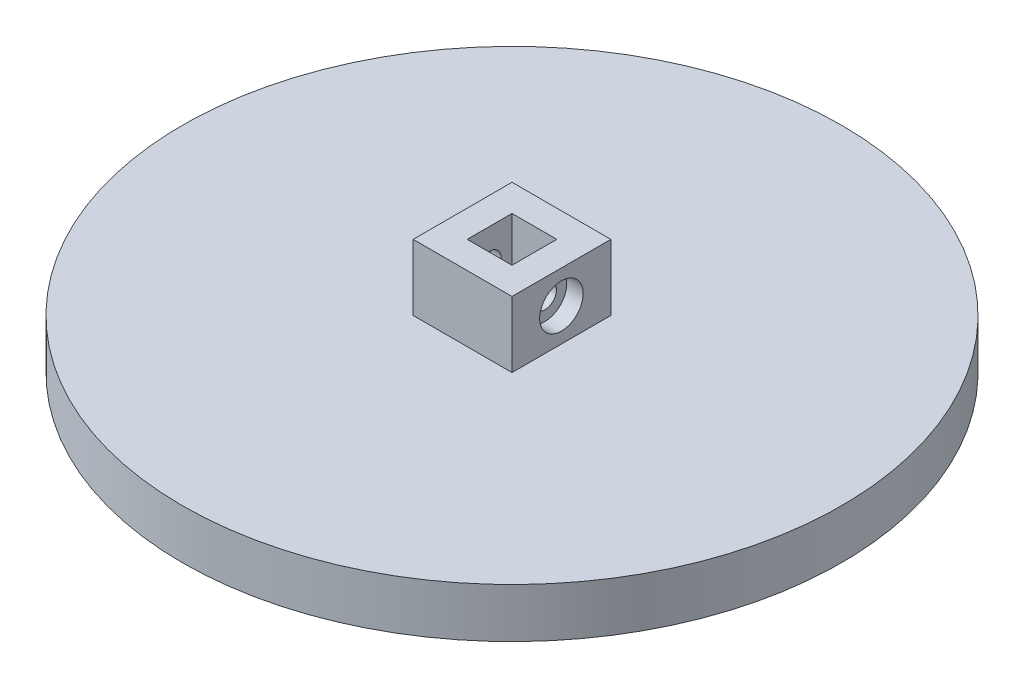
from build123d import *

# Parameters (mm, degrees)
SKETCH1_R           = 50
BOSS_EXTRUDE1_DEPTH = 7.5
SKETCH2_W           = 15
SKETCH2_H           = 15
BOSS_EXTRUDE2_DEPTH = 10
SKETCH3_R           = 1.75
CUT_EXTRUDE1_DEPTH  = 15
SKETCH4_R           = 3.3
CUT_EXTRUDE2_DEPTH  = 2.5
CUT_EXTRUDE3_DEPTH  = 2.5
SKETCH6_W           = 6.8
SKETCH6_H           = 6.8
CUT_EXTRUDE4_DEPTH  = 17.5


with BuildPart() as part:
    # Sketch1 → Boss-Extrude1 (new body)
    with BuildSketch(Plane(origin=(0, 0, 0), x_dir=(1, 0, 0), z_dir=(0, 1, 0))):
        with Locations(Location((0, 0, 0), (0, 0, 270))):
            Circle(SKETCH1_R)
    extrude(amount=BOSS_EXTRUDE1_DEPTH)

    # Sketch2 → Boss-Extrude2 (add)
    with BuildSketch(Plane(origin=(0, 7.5, 0), x_dir=(1, 0, 0), z_dir=(0, 1, 0))):
        Rectangle(SKETCH2_W, SKETCH2_H)
    extrude(amount=BOSS_EXTRUDE2_DEPTH)

    # Sketch3 → Cut-Extrude1 (cut)
    with BuildSketch(Plane(origin=(7.5, 0, 0), x_dir=(0, 0, -1), z_dir=(1, 0, 0))):
        with Locations((0, 12.5)):
            Circle(SKETCH3_R)
    extrude(amount=-CUT_EXTRUDE1_DEPTH, mode=Mode.SUBTRACT)

    # Sketch4 → Cut-Extrude2 (cut)
    with BuildSketch(Plane(origin=(7.5, 0, 0), x_dir=(0, 0, -1), z_dir=(1, 0, 0))):
        with Locations((0, 12.5)):
            Circle(SKETCH4_R)
    extrude(amount=-CUT_EXTRUDE2_DEPTH, mode=Mode.SUBTRACT)

    # Sketch5 → Cut-Extrude3 (cut)
    with BuildSketch(Plane.ZY.offset(7.5)):
        Polygon((-3.35, 12.5), (-1.675, 9.598814897), (1.675, 9.598814897), (3.35, 12.5), (1.675, 15.401185103), (-1.675, 15.401185103), align=None)
    extrude(amount=-CUT_EXTRUDE3_DEPTH, mode=Mode.SUBTRACT)

    # Sketch6 → Cut-Extrude4 (cut)
    with BuildSketch(Plane(origin=(0, 17.5, 0), x_dir=(1, 0, 0), z_dir=(0, 1, 0))):
        Rectangle(SKETCH6_W, SKETCH6_H)
    extrude(amount=-CUT_EXTRUDE4_DEPTH, mode=Mode.SUBTRACT)


solid = part.part
